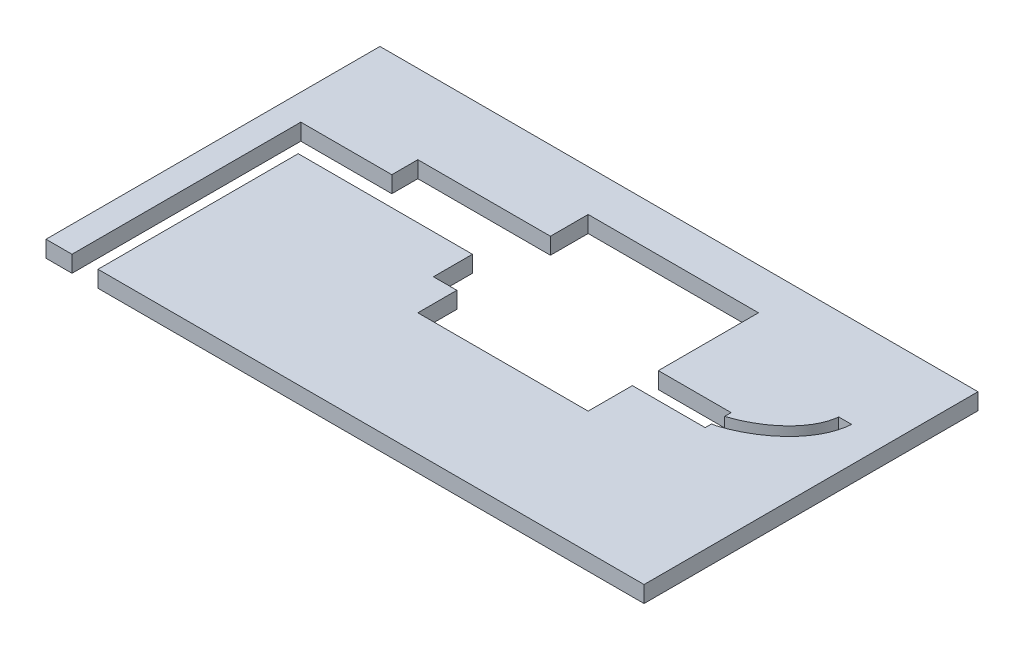
from build123d import *

# Parameters (mm, degrees)
BOSS_EXTRUDE1_DEPTH = 6.35


with BuildPart() as part:
    # Sketch1 → Boss-Extrude1 (new body)
    with BuildSketch(Plane(origin=(0, 0, 0), x_dir=(1, 0, 0), z_dir=(0, 1, 0))):
        with BuildLine():
            Line((-115, -64.215517859), (-105, -64.215517859))
            Line((-105, -64.215517859), (-105, 23.784482141))
            Line((-105, 23.784482141), (-70, 23.784482141))
            Line((-70, 23.784482141), (-70, 33.784482141))
            Line((-70, 33.784482141), (-19, 33.784482141))
            Line((-19, 33.784482141), (-19, 48.284482141))
            Line((-19, 48.284482141), (46.5, 48.284482141))
            Line((46.5, 48.284482141), (46.5, 9.784482141))
            Line((46.5, 9.784482141), (74.5, 9.784482141))
            Line((74.5, 9.784482141), (74.5, 7.284482141))
            add(Edge.make_bspline(
                [(74.5, 7.284482141), (78.941812559, 8.679963078), (89.598105333, 14.160361523), (96.061867219, 23.189471951), (96.610613644, 29.034482141)],
                knots=[0, 0, 0, 0, 0.139776101, 0.343963844, 0.343963844, 0.343963844, 0.343963844], degree=3))
            Line((96.610613644, 29.034482141), (101.594478802, 29.034482141))
            add(Edge.make_bspline(
                [(75.956941241, 2.501457761), (80.440075067, 3.907014197), (86.917003439, 7.092067173), (94.089056782, 13.146274012), (98.414454942, 18.57956616), (100.864778933, 24.020415983), (101.497230208, 27.680092848), (101.594478802, 29.034482141)],
                knots=[0, 0, 0, 0, 0.125, 0.1875, 0.25, 0.3125, 0.348130447, 0.348130447, 0.348130447, 0.348130447], degree=3))
            Line((75.956941241, 2.501457761), (74.5, 2.284482141))
            Line((74.5, 2.284482141), (74.5, -0.215517859))
            Line((74.5, -0.215517859), (46.5, -0.215517859))
            Line((46.5, -0.215517859), (46.5, -17.215517859))
            Line((46.5, -17.215517859), (-19, -17.215517859))
            Line((-19, -17.215517859), (-19, -2.215517859))
            Line((-19, -2.215517859), (-28, -2.215517859))
            Line((-28, -2.215517859), (-28, 12.784482141))
            Line((-28, 12.784482141), (-95, 12.784482141))
            Line((-95, 12.784482141), (-95, -64.215517859))
            Line((-95, -64.215517859), (115, -64.215517859))
            Line((115, -64.215517859), (115, 64.215517859))
            Line((115, 64.215517859), (-115, 64.215517859))
            Line((-115, 64.215517859), (-115, -64.215517859))
        make_face()
    extrude(amount=BOSS_EXTRUDE1_DEPTH)


solid = part.part
